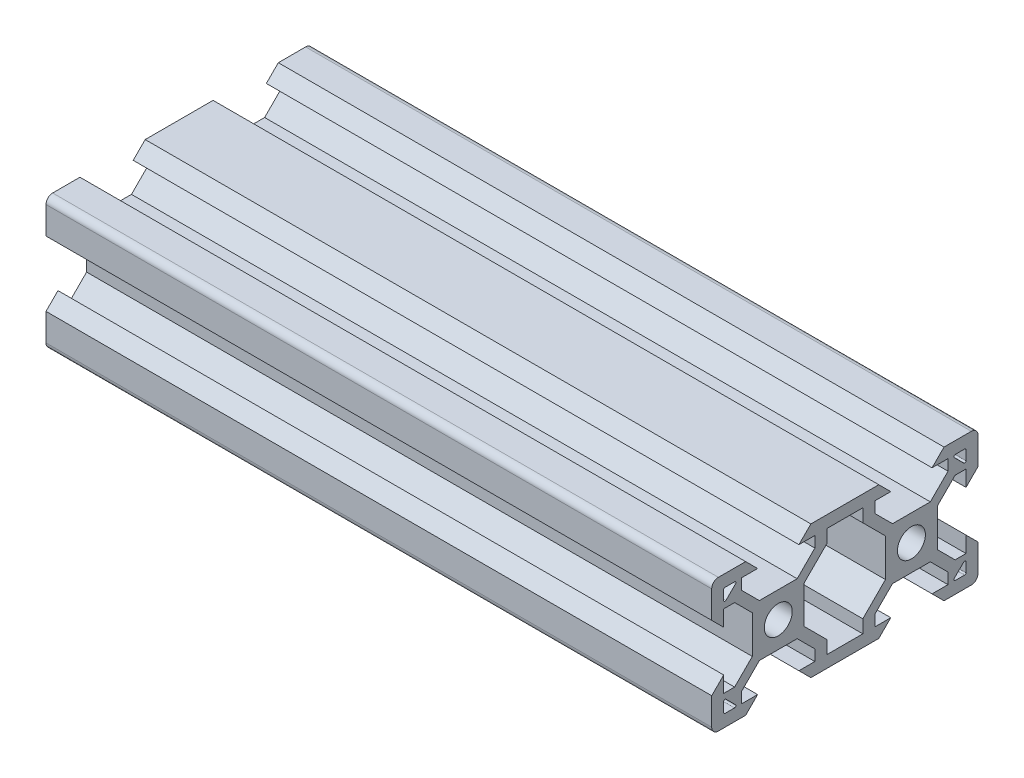
from build123d import *

# Parameters (mm, degrees)
SKETCH5_R           = 2.1
BOSS_EXTRUDE1_DEPTH = 50


with BuildPart() as part:
    # Sketch5 → Boss-Extrude1 (new, symmetric)
    with BuildSketch(Plane(origin=(0, 0, 0), x_dir=(0, 0, -1), z_dir=(1, 0, 0))):
        with BuildLine():
            Line((-19.998019485, 4.9), (-18.198019485, 3.1))
            Line((-18.198019485, 3.1), (-18.198019485, 5.499339828))
            Line((-18.198019485, 5.499339828), (-16.558019485, 5.499339828))
            Line((-16.558019485, 5.499339828), (-13.9, 2.841320344))
            Line((-13.9, 2.841320344), (-13.9, -2.838679656))
            Line((-13.9, -2.838679656), (-16.558019485, -5.496699141))
            Line((-16.558019485, -5.496699141), (-18.198019485, -5.496699141))
            Line((-18.198019485, -5.496699141), (-18.198019485, -3.1))
            Line((-18.198019485, -3.1), (-19.998019485, -4.9))
            Line((-19.998019485, -4.9), (-19.998019485, -9))
            ThreePointArc((-19.998019485, -9), (-19.705126266, -9.707106781), (-18.998019485, -10))
            Line((-18.998019485, -10), (-14.9, -10))
            Line((-14.9, -10), (-13.1, -8.2))
            Line((-13.1, -8.2), (-15.5, -8.2))
            Line((-15.5, -8.2), (-15.5, -6.56))
            Line((-15.5, -6.56), (-12.84, -3.9))
            Line((-12.84, -3.9), (-7.16, -3.9))
            Line((-7.16, -3.9), (-4.5, -6.56))
            Line((-4.5, -6.56), (-4.5, -8.2))
            Line((-4.5, -8.2), (-6.9, -8.2))
            Line((-6.9, -8.2), (-5.1, -10))
            Line((-5.1, -10), (5.1, -10))
            Line((5.1, -10), (6.9, -8.2))
            Line((6.9, -8.2), (4.496038969, -8.2))
            Line((4.496038969, -8.2), (4.496038969, -6.56))
            Line((4.496038969, -6.56), (7.156038969, -3.9))
            Line((7.156038969, -3.9), (12.836038969, -3.9))
            Line((12.836038969, -3.9), (15.496038969, -6.56))
            Line((15.496038969, -6.56), (15.496038969, -8.2))
            Line((15.496038969, -8.2), (13.1, -8.2))
            Line((13.1, -8.2), (14.9, -10))
            Line((14.9, -10), (19.001980515, -10))
            ThreePointArc((19.001980515, -10), (19.709087297, -9.707106781), (20.001980515, -9))
            Line((20.001980515, -9), (20.001980515, -4.9))
            Line((20.001980515, -4.9), (18.201980515, -3.1))
            Line((18.201980515, -3.1), (18.201980515, -5.504621202))
            Line((18.201980515, -5.504621202), (16.561980515, -5.504621202))
            Line((16.561980515, -5.504621202), (13.9, -2.842640687))
            Line((13.9, -2.842640687), (13.9, 2.837359313))
            Line((13.9, 2.837359313), (16.561980515, 5.499339828))
            Line((16.561980515, 5.499339828), (18.201980515, 5.499339828))
            Line((18.201980515, 5.499339828), (18.201980515, 3.1))
            Line((18.201980515, 3.1), (20.001980515, 4.9))
            Line((20.001980515, 4.9), (20.001980515, 9))
            ThreePointArc((20.001980515, 9), (19.709087297, 9.707106781), (19.001980515, 10))
            Line((19.001980515, 10), (14.9, 10))
            Line((14.9, 10), (13.1, 8.2))
            Line((13.1, 8.2), (15.501320344, 8.2))
            Line((15.501320344, 8.2), (15.501320344, 6.56))
            Line((15.501320344, 6.56), (12.841320344, 3.9))
            Line((12.841320344, 3.9), (7.161320344, 3.9))
            Line((7.161320344, 3.9), (4.501320344, 6.56))
            Line((4.501320344, 6.56), (4.501320344, 8.2))
            Line((4.501320344, 8.2), (6.9, 8.2))
            Line((6.9, 8.2), (5.1, 10))
            Line((5.1, 10), (-5.1, 10))
            Line((-5.1, 10), (-6.9, 8.2))
            Line((-6.9, 8.2), (-4.501320344, 8.2))
            Line((-4.501320344, 8.2), (-4.501320344, 6.56))
            Line((-4.501320344, 6.56), (-7.161320344, 3.9))
            Line((-7.161320344, 3.9), (-12.841320344, 3.9))
            Line((-12.841320344, 3.9), (-15.501320344, 6.56))
            Line((-15.501320344, 6.56), (-15.501320344, 8.2))
            Line((-15.501320344, 8.2), (-13.1, 8.2))
            Line((-13.1, 8.2), (-14.9, 10))
            Line((-14.9, 10), (-18.998019485, 10))
            ThreePointArc((-18.998019485, 10), (-19.705126266, 9.707106781), (-19.998019485, 9))
            Line((-19.998019485, 9), (-19.998019485, 4.9))
        make_face()
        with Locations((-10, 0)):
            Circle(SKETCH5_R, mode=Mode.SUBTRACT)
        with Locations((10, 0)):
            Circle(SKETCH5_R, mode=Mode.SUBTRACT)
        Polygon((6.1, -2.84), (6.1, 2.84), (2.7, 6.24), (2.7, 8.2), (-2.7, 8.2), (-2.7, 6.24), (-6.1, 2.84), (-6.1, -2.84), (-2.7, -6.24), (-2.7, -8.2), (2.7, -8.2), (2.7, -6.24), align=None, mode=Mode.SUBTRACT)
        with BuildLine():
            Line((16.571320344, 8.2), (18.001980515, 8.2))
            ThreePointArc((18.001980515, 8.2), (18.143401872, 8.141421356), (18.201980515, 8))
            Line((18.201980515, 8), (18.201980515, 6.569339828))
            ThreePointArc((18.201980515, 6.569339828), (18.078517202, 6.384563922), (17.860559159, 6.427918472))
            Line((17.860559159, 6.427918472), (16.429898987, 7.858578644))
            ThreePointArc((16.429898987, 7.858578644), (16.386544437, 8.076536686), (16.571320344, 8.2))
        make_face(mode=Mode.SUBTRACT)
        with BuildLine():
            Line((16.571320344, -8.2), (18.001980515, -8.2))
            ThreePointArc((18.001980515, -8.2), (18.143401872, -8.141421356), (18.201980515, -8))
            Line((18.201980515, -8), (18.201980515, -6.569339828))
            ThreePointArc((18.201980515, -6.569339828), (18.078517202, -6.384563922), (17.860559159, -6.427918472))
            Line((17.860559159, -6.427918472), (16.429898987, -7.858578644))
            ThreePointArc((16.429898987, -7.858578644), (16.386544437, -8.076536686), (16.571320344, -8.2))
        make_face(mode=Mode.SUBTRACT)
        with BuildLine():
            Line((-17.860559159, 6.427918472), (-16.429898987, 7.858578644))
            ThreePointArc((-16.429898987, 7.858578644), (-16.386544437, 8.076536686), (-16.571320344, 8.2))
            Line((-16.571320344, 8.2), (-18.001980515, 8.2))
            ThreePointArc((-18.001980515, 8.2), (-18.143401872, 8.141421356), (-18.201980515, 8))
            Line((-18.201980515, 8), (-18.201980515, 6.569339828))
            ThreePointArc((-18.201980515, 6.569339828), (-18.078517202, 6.384563922), (-17.860559159, 6.427918472))
        make_face(mode=Mode.SUBTRACT)
        with BuildLine():
            Line((-16.571320344, -8.2), (-18.001980515, -8.2))
            ThreePointArc((-18.001980515, -8.2), (-18.143401872, -8.141421356), (-18.201980515, -8))
            Line((-18.201980515, -8), (-18.201980515, -6.569339828))
            ThreePointArc((-18.201980515, -6.569339828), (-18.078517202, -6.384563922), (-17.860559159, -6.427918472))
            Line((-17.860559159, -6.427918472), (-16.429898987, -7.858578644))
            ThreePointArc((-16.429898987, -7.858578644), (-16.386544437, -8.076536686), (-16.571320344, -8.2))
        make_face(mode=Mode.SUBTRACT)
    extrude(amount=BOSS_EXTRUDE1_DEPTH, both=True)


solid = part.part
